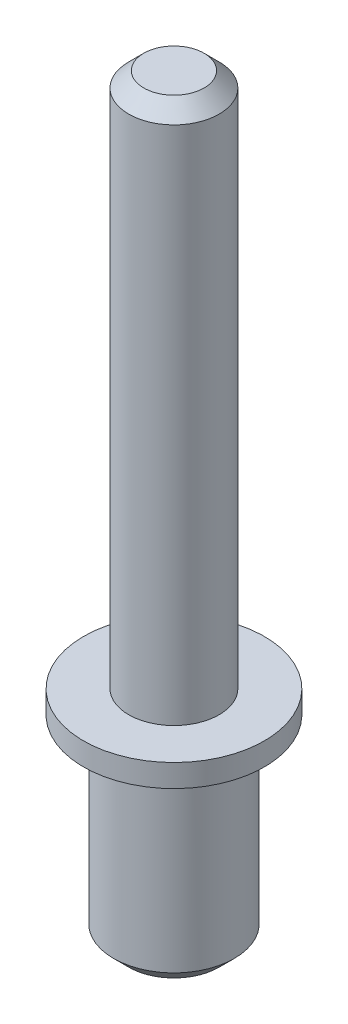
from build123d import *

# Parameters (mm, degrees)
CHAMFER_1_SIZE = 1
CHAMFER_2_SIZE = 1


with BuildPart() as part:
    # 草图1 → 旋转1 (revolve)
    with BuildSketch(Plane.XY):
        Polygon((0, 0), (-4, 0), (-4, 13), (-6, 13), (-6, 14.5), (-3, 14.5), (-3, 50), (0, 50), align=None)
    revolve(axis=Axis((0, 50, 0), (0, -1, 0)))

    # 倒角1
    chamfer_1_edges = [part.edges().sort_by_distance(p)[0] for p in [
        (4, 0, 0),
    ]]
    chamfer(chamfer_1_edges, length=CHAMFER_1_SIZE)

    # 倒角2
    chamfer_2_edges = [part.edges().sort_by_distance(p)[0] for p in [
        (3, 50, 0),
    ]]
    chamfer(chamfer_2_edges, length=CHAMFER_2_SIZE)


solid = part.part
